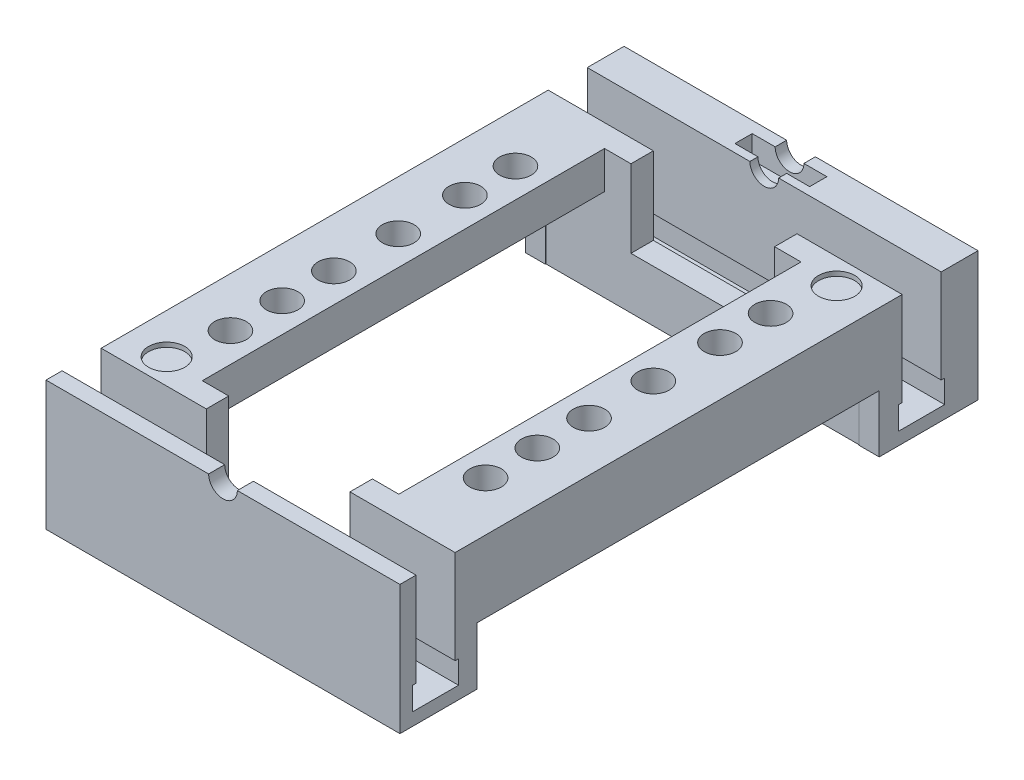
from build123d import *

# Parameters (mm, degrees)
SKETCH1_W                = 78.232
SKETCH1_H                = 62.23
BOSS_EXTRUDE1_DEPTH      = 128.27
SKETCH2_W                = 43.434
SKETCH2_H                = 88.9
CUT_EXTRUDE1_DEPTH       = 44.45
SKETCH3_W                = 69.342
SKETCH3_H                = 88.9
CUT_EXTRUDE2_DEPTH       = 22.86
CUT_EXTRUDE3_DEPTH       = 163.622297438
CUT_EXTRUDE3_DEPTH_BACK  = 163.622297438
SKETCH4_R                = 3.175
CUT_EXTRUDE4_DEPTH       = 156.317209684
CUT_EXTRUDE4_DEPTH_BACK  = 156.317209684
SKETCH6_R                = 3.4925
CUT_EXTRUDE6_DEPTH       = 163.622297438
CUT_EXTRUDE6_DEPTH_BACK  = 163.622297438
CUT_EXTRUDE7_DEPTH       = 163.622297438
CUT_EXTRUDE7_DEPTH_BACK  = 163.622297438
CUT_EXTRUDE8_DEPTH       = 159.64613082
CUT_EXTRUDE8_DEPTH_BACK  = 107.95
SKETCH9_W                = 44.45
SKETCH9_H                = 5.08
SKETCH10_W               = 38.1
SKETCH10_H               = 80.01
CUT_EXTRUDE9_DEPTH       = 19.05
CUT_EXTRUDE10_START      = -6.35
SKETCH11_W               = 31.75
SKETCH11_H               = 34.29
CUT_EXTRUDE10_DEPTH      = 101.6
CUT_EXTRUDE11_DEPTH      = 159.64613082
CUT_EXTRUDE11_DEPTH_BACK = 159.64613082
SKETCH12_W               = 78.232
SKETCH12_H               = 31.115
BOSS_EXTRUDE4_START      = 4.572
BOSS_EXTRUDE4_DEPTH      = 4.572
CUT_EXTRUDE12_DEPTH      = 151.813823468
CUT_EXTRUDE12_DEPTH_BACK = 5.08
SKETCH18_W               = 16.51
SKETCH18_H               = 3.81
CUT_EXTRUDE13_DEPTH      = 150.066084318
CUT_EXTRUDE13_DEPTH_BACK = 150.066084318
SKETCH19_W               = 88.9
SKETCH19_H               = 12.7
SKETCH13_R               = 4.0005
CUT_EXTRUDE14_DEPTH      = 1.016
MOVE_FACE1_BY            = 0.762
MOVE_FACE1_2_BY          = 0.762
MOVE_FACE1_3_BY          = 0.762
MOVE_FACE1_4_BY          = 0.762


with BuildPart() as part:
    # Sketch1 → Boss-Extrude1 (new body)
    with BuildSketch(Plane.XY):
        with Locations((39.116, 31.115)):
            Rectangle(SKETCH1_W, SKETCH1_H)
    extrude(amount=BOSS_EXTRUDE1_DEPTH)

    # Sketch2 → Cut-Extrude1 (cut)
    with BuildSketch(Plane.XZ):
        with Locations((39.116, 64.135)):
            Rectangle(SKETCH2_W, SKETCH2_H)
    extrude(amount=-CUT_EXTRUDE1_DEPTH, mode=Mode.SUBTRACT)

    # Sketch3 → Cut-Extrude2 (cut)
    with BuildSketch(Plane.XZ):
        with Locations((39.116, 64.135)):
            Rectangle(SKETCH3_W, SKETCH3_H)
    extrude(amount=-CUT_EXTRUDE2_DEPTH, mode=Mode.SUBTRACT)

    # Sketch4 → Cut-Extrude3 (cut, two sides: drawn at the far end of the back side and taken through both)
    with BuildSketch(Plane(origin=(0, 0, 0), x_dir=(-1, 0, 0), z_dir=(0, 0, -1)).offset(-CUT_EXTRUDE3_DEPTH_BACK)):
        with Locations((-39.116, 31.115)):
            Circle(SKETCH4_R)
    extrude(amount=CUT_EXTRUDE3_DEPTH + CUT_EXTRUDE3_DEPTH_BACK, mode=Mode.SUBTRACT)

    # Sketch6 → Cut-Extrude4 (cut, two sides: drawn at the far end of the back side and taken through both)
    with BuildSketch(Plane.XZ.offset(-22.86).offset(-CUT_EXTRUDE4_DEPTH_BACK)):
        with Locations(Location((10.922, 32.893, 0), (0, 0, 270))):
            Circle(SKETCH6_R)
        with Locations(Location((10.922, 44.069, 0), (0, 0, 270))):
            Circle(SKETCH6_R)
        with Locations(Location((10.922, 58.801, 0), (0, 0, 270))):
            Circle(SKETCH6_R)
        with Locations(Location((10.922, 73.025, 0), (0, 0, 270))):
            Circle(SKETCH6_R)
        with Locations(Location((10.922, 84.455, 0), (0, 0, 270))):
            Circle(SKETCH6_R)
        with Locations(Location((10.922, 95.885, 0), (0, 0, 270))):
            Circle(SKETCH6_R)
        with Locations(Location((67.31, 95.885, 0), (0, 0, 270))):
            Circle(SKETCH6_R)
        with Locations(Location((67.31, 84.455, 0), (0, 0, 270))):
            Circle(SKETCH6_R)
        with Locations(Location((67.31, 73.025, 0), (0, 0, 270))):
            Circle(SKETCH6_R)
        with Locations(Location((67.31, 58.801, 0), (0, 0, 270))):
            Circle(SKETCH6_R)
        with Locations(Location((67.31, 44.069, 0), (0, 0, 270))):
            Circle(SKETCH6_R)
        with Locations(Location((67.31, 32.893, 0), (0, 0, 270))):
            Circle(SKETCH6_R)
    extrude(amount=CUT_EXTRUDE4_DEPTH + CUT_EXTRUDE4_DEPTH_BACK, mode=Mode.SUBTRACT)

    # Sketch7 → Cut-Extrude6 (cut, two sides: drawn at the far end of the back side and taken through both)
    with BuildSketch(Plane(origin=(78.232, 0, 0), x_dir=(0, 0, -1), z_dir=(1, 0, 0)).offset(-CUT_EXTRUDE6_DEPTH_BACK)):
        Polygon((-122.936, 58.42), (-122.936, 53.34), (-121.412, 53.34), (-121.412, 10.414), (-122.936, 10.414), (-122.936, 5.334), (-112.776, 5.334), (-112.776, 10.414), (-114.3, 10.414), (-114.3, 53.34), (-112.776, 53.34), (-112.776, 58.42), align=None)
        Polygon((-15.494, 58.42), (-15.494, 53.34), (-13.97, 53.34), (-13.97, 10.414), (-15.494, 10.414), (-15.494, 5.334), (-5.334, 5.334), (-5.334, 10.414), (-6.858, 10.414), (-6.858, 53.34), (-5.334, 53.34), (-5.334, 58.42), align=None)
    extrude(amount=CUT_EXTRUDE6_DEPTH + CUT_EXTRUDE6_DEPTH_BACK, mode=Mode.SUBTRACT)

    # Sketch8 → Cut-Extrude7 (cut, two sides: drawn at the far end of the back side and taken through both)
    with BuildSketch(Plane(origin=(78.232, 0, 0), x_dir=(0, 0, -1), z_dir=(1, 0, 0)).offset(-CUT_EXTRUDE7_DEPTH_BACK)):
        Polygon((-128.27, 62.23), (-125.73, 62.23), (-125.73, 2.54), (-2.54, 2.54), (-2.54, 62.23), (0, 62.23), (0, 0), (-128.27, 0), align=None)
    extrude(amount=CUT_EXTRUDE7_DEPTH + CUT_EXTRUDE7_DEPTH_BACK, mode=Mode.SUBTRACT)

    # Sketch9 → Cut-Extrude8 (cut, two sides: drawn at the far end of the back side and taken through both)
    with BuildSketch(Plane(origin=(0, 0, 2.54), x_dir=(-1, 0, 0), z_dir=(0, 0, -1)).offset(-CUT_EXTRUDE8_DEPTH_BACK)):
        with Locations((-39.116, 57.15)):
            Rectangle(SKETCH9_W, SKETCH9_H)
    extrude(amount=CUT_EXTRUDE8_DEPTH + CUT_EXTRUDE8_DEPTH_BACK, mode=Mode.SUBTRACT)

    # Sketch10 → Cut-Extrude9 (cut)
    with BuildSketch(Plane(origin=(0, 62.23, 0), x_dir=(1, 0, 0), z_dir=(0, 1, 0))):
        with Locations((39.243, -64.135)):
            Rectangle(SKETCH10_W, SKETCH10_H)
    extrude(amount=-CUT_EXTRUDE9_DEPTH, mode=Mode.SUBTRACT)

    # Sketch11 → Cut-Extrude10 (cut)
    with BuildSketch(Plane(origin=(0, 0, 108.585), x_dir=(-1, 0, 0), z_dir=(0, 0, -1)).offset(CUT_EXTRUDE10_START)):
        with Locations((-39.116, 31.115)):
            Rectangle(SKETCH11_W, SKETCH11_H)
    extrude(amount=CUT_EXTRUDE10_DEPTH, mode=Mode.SUBTRACT)

    # Sketch12 → Cut-Extrude11 (cut, two sides: drawn at the far end of the back side and taken through both)
    with BuildSketch(Plane.XY.offset(125.73).offset(-CUT_EXTRUDE11_DEPTH_BACK)):
        with Locations((39.116, 46.6725)):
            Rectangle(SKETCH12_W, SKETCH12_H)
    extrude(amount=CUT_EXTRUDE11_DEPTH + CUT_EXTRUDE11_DEPTH_BACK, mode=Mode.SUBTRACT)

    # Sketch17 → Boss-Extrude4 (add)
    with BuildSketch(Plane(origin=(0, 0, 2.54), x_dir=(-1, 0, 0), z_dir=(0, 0, -1)).offset(BOSS_EXTRUDE4_START)):
        with BuildLine():
            Line((-78.232, 31.115), (-42.291, 31.115))
            ThreePointArc((-42.291, 31.115), (-41.36106403, 28.86993597), (-39.116, 27.94))
            ThreePointArc((-39.116, 27.94), (-36.87093597, 28.86993597), (-35.941, 31.115))
            Line((-35.941, 31.115), (0, 31.115))
            Line((0, 31.115), (0, 2.54))
            Line((0, 2.54), (-78.232, 2.54))
            Line((-78.232, 2.54), (-78.232, 31.115))
        make_face()
    extrude(amount=-BOSS_EXTRUDE4_DEPTH)

    # Sketch18 → Cut-Extrude12 (cut, two sides: drawn at the far end of the back side and taken through both)
    with BuildSketch(Plane(origin=(0, 31.115, 0), x_dir=(1, 0, 0), z_dir=(0, 1, 0)).offset(-CUT_EXTRUDE12_DEPTH_BACK)):
        with Locations((39.116, -2.413)):
            Rectangle(SKETCH18_W, SKETCH18_H)
    extrude(amount=CUT_EXTRUDE12_DEPTH + CUT_EXTRUDE12_DEPTH_BACK, mode=Mode.SUBTRACT)

    # Sketch19 → Cut-Extrude13 (cut, two sides: drawn at the far end of the back side and taken through both)
    with BuildSketch(Plane.ZY.offset(-73.787).offset(-CUT_EXTRUDE13_DEPTH_BACK)):
        with Locations((64.248626707, 8.89)):
            Rectangle(SKETCH19_W, SKETCH19_H)
    extrude(amount=CUT_EXTRUDE13_DEPTH + CUT_EXTRUDE13_DEPTH_BACK, mode=Mode.SUBTRACT)

    # Sketch13 → Cut-Extrude14 (cut)
    with BuildSketch(Plane(origin=(0, 31.115, 0), x_dir=(1, 0, 0), z_dir=(0, 1, 0))):
        with Locations(Location((69.342, -20.32, 0), (0, 0, 270))):
            Circle(SKETCH13_R)
        with Locations(Location((8.89, -107.95, 0), (0, 0, 270))):
            Circle(SKETCH13_R)
    extrude(amount=-CUT_EXTRUDE14_DEPTH, mode=Mode.SUBTRACT)

    # Move Face1: a face moved inward by 0.762
    extrude(part.faces().sort_by_distance((39.116, 20.675603328, 6.858))[0], amount=MOVE_FACE1_BY, dir=(0, 0, -1), mode=Mode.SUBTRACT)

    # Move Face1 2: a face moved inward by 0.762
    extrude(part.faces().sort_by_distance((58.674, 20.7645, 13.97))[0], amount=MOVE_FACE1_2_BY, dir=(0, 0, 1), mode=Mode.SUBTRACT)

    # Move Face1 3: a face moved inward by 0.762
    extrude(part.faces().sort_by_distance((58.674, 20.7645, 114.3))[0], amount=MOVE_FACE1_3_BY, dir=(0, 0, -1), mode=Mode.SUBTRACT)

    # Move Face1 4: a face moved inward by 0.762
    extrude(part.faces().sort_by_distance((39.116, 20.675603328, 121.412))[0], amount=MOVE_FACE1_4_BY, dir=(0, 0, 1), mode=Mode.SUBTRACT)


solid = part.part
